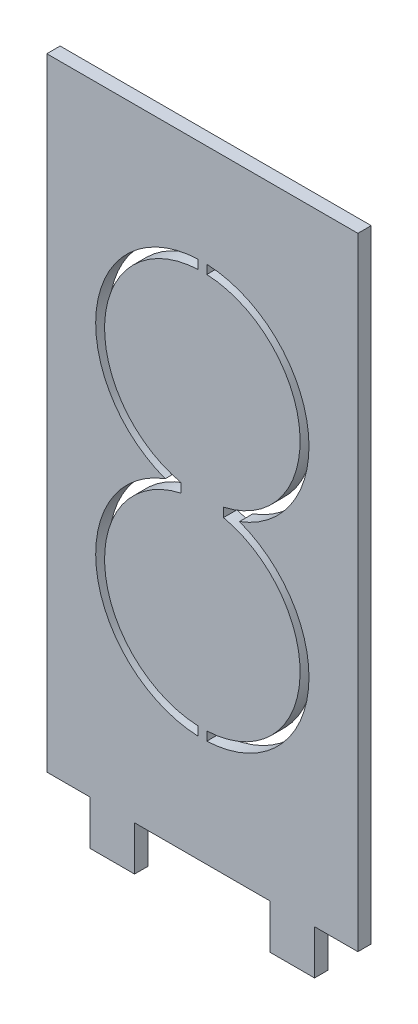
from build123d import *

# Parameters (mm, degrees)
SKIZZE1_W                        = 35
SKIZZE1_H                        = 75
AUFSATZ_LINEAR_AUSTRAGEN1_DEPTH  = 1.5
SKIZZE3_W                        = 15.25
SKIZZE3_H                        = 5
SKIZZE3_W_2                      = 4.875
SCHNITT_LINEAR_AUSTRAGEN12_DEPTH = 20
SCHNITT_LINEAR_AUSTRAGEN18_DEPTH = 1.5
SKIZZE14_W                       = 1
SKIZZE14_H                       = 57.312152727
AUFSATZ_LINEAR_AUSTRAGEN2_DEPTH  = 1.5


with BuildPart() as part:
    # Skizze1 → Aufsatz-Linear austragen1 (new body)
    with BuildSketch(Plane.XY):
        with Locations((17.5, 37.5)):
            Rectangle(SKIZZE1_W, SKIZZE1_H)
    extrude(amount=AUFSATZ_LINEAR_AUSTRAGEN1_DEPTH)

    # Skizze3 → Schnitt-Linear austragen12 (cut)
    with BuildSketch(Plane.XY.offset(1.5)):
        with Locations((17.5, 2.5)):
            Rectangle(SKIZZE3_W, SKIZZE3_H)
        with Locations((32.5625, 2.5)):
            Rectangle(SKIZZE3_W_2, SKIZZE3_H)
        with Locations((2.4375, 2.5)):
            Rectangle(SKIZZE3_W_2, SKIZZE3_H)
    extrude(amount=-SCHNITT_LINEAR_AUSTRAGEN12_DEPTH, mode=Mode.SUBTRACT)

    # Skizze13 → Schnitt-Linear austragen18 (cut)
    with BuildSketch(Plane.XY.offset(1.5)):
        with BuildLine():
            ThreePointArc((21.674459995, 40.249493876), (17.5, 63.500000179), (13.325540005, 40.249493876))
            ThreePointArc((13.325540005, 40.249493876), (17.5, 17.000948841), (21.674459995, 40.249493876))
        make_face()
        with BuildLine():
            Line((15.117508566, 40.761111111), (15.117508566, 39.738888889))
            ThreePointArc((15.117508566, 39.738888889), (17.5, 18), (19.882491434, 39.738888889))
            Line((19.882491434, 39.738888889), (19.882491434, 40.761111111))
            ThreePointArc((19.882491434, 40.761111111), (17.5, 62.5), (15.117508566, 40.761111111))
        make_face(mode=Mode.SUBTRACT)
    extrude(amount=-SCHNITT_LINEAR_AUSTRAGEN18_DEPTH, mode=Mode.SUBTRACT)


with BuildPart() as schnitt_linear_austragen18_piece_1:
    # of the separate pieces the step leaves, piece 1, a body of its own (schnitt_linear_austragen18_pieces)
    add(part.part.solids().sort_by_distance((4.875, 0, 0))[0])



with BuildPart() as schnitt_linear_austragen18_piece_2:
    # of the separate pieces the step leaves, piece 2, a body of its own (schnitt_linear_austragen18_pieces)
    add(part.part.solids().sort_by_distance((19.882491434, 39.738888889, 0))[0])


with BuildPart() as schnitt_linear_austragen18_piece_1_1:
    add(schnitt_linear_austragen18_piece_1.part)

    add(schnitt_linear_austragen18_piece_2.part)  # Aufsatz-Linear austragen2 merges Schnitt-Linear austragen18 piece 2
    # Skizze14 → Aufsatz-Linear austragen2 (add)
    with BuildSketch(Plane.XY.offset(1.5)):
        with Locations((17.5, 39.529651928)):
            Rectangle(SKIZZE14_W, SKIZZE14_H)
    extrude(amount=-AUFSATZ_LINEAR_AUSTRAGEN2_DEPTH)


solid = schnitt_linear_austragen18_piece_1_1.part
